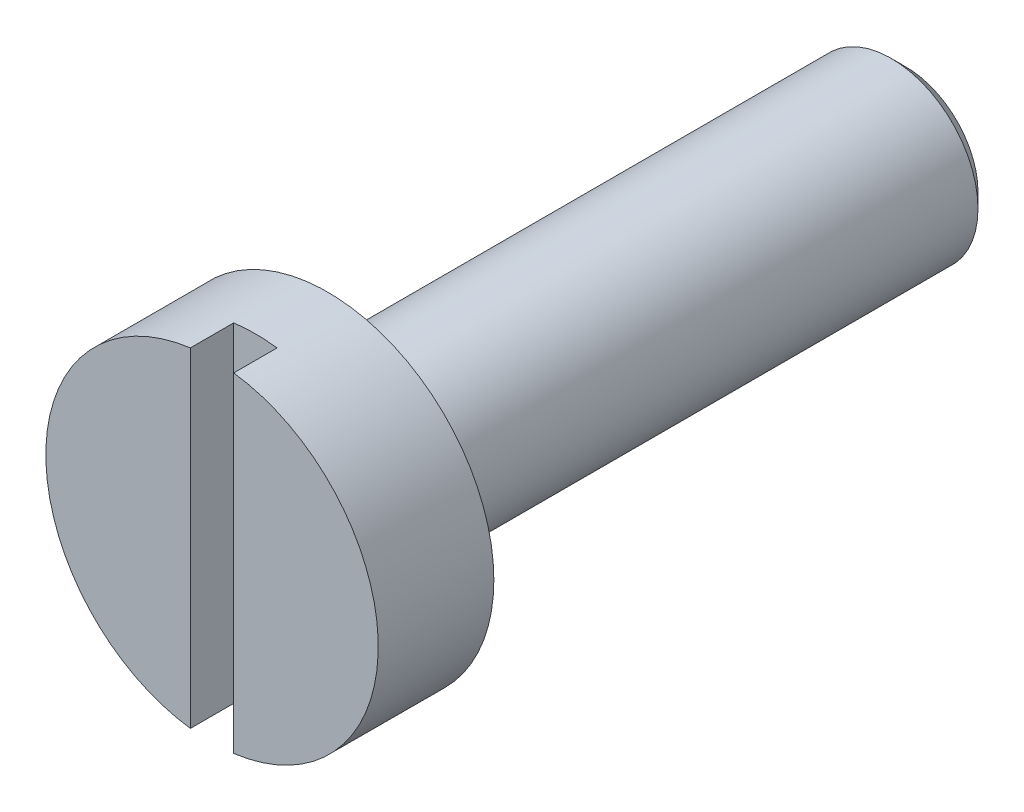
from build123d import *

# Parameters (mm, degrees)
SKETCH_1_R          = 1.15
EXTRUDE_1_DEPTH     = 0.8
SKETCH_2_R          = 0.6
EXTRUDE_2_DEPTH     = 4
CHAMFER_1_SIZE      = 0.1
SKETCH_3_W          = 0.3
SKETCH_3_H          = 2.389220408
CUT_EXTRUDE_1_DEPTH = 0.3


with BuildPart() as part:
    # Эскиз1 → Бобышка-Вытянуть1 (new body)
    with BuildSketch(Plane.XY):
        Circle(SKETCH_1_R)
    extrude(amount=EXTRUDE_1_DEPTH)

    # Эскиз2 → Бобышка-Вытянуть2 (add)
    with BuildSketch(Plane.XY):
        Circle(SKETCH_2_R)
    extrude(amount=-EXTRUDE_2_DEPTH)

    # Фаска1
    chamfer_1_edges = [part.edges().sort_by_distance(p)[0] for p in [
        (-0.6, 0, -4),
    ]]
    chamfer(chamfer_1_edges, length=CHAMFER_1_SIZE)

    # Эскиз3 → Вырез-Вытянуть1 (cut)
    with BuildSketch(Plane.XY.offset(0.8)):
        Rectangle(SKETCH_3_W, SKETCH_3_H)
    extrude(amount=-CUT_EXTRUDE_1_DEPTH, mode=Mode.SUBTRACT)


solid = part.part
